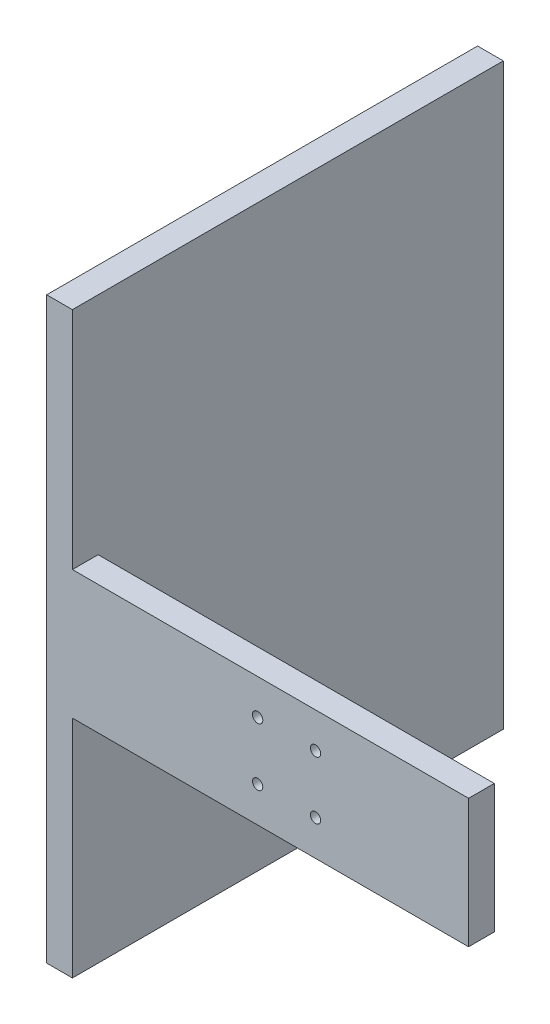
from build123d import *

# Parameters (mm, degrees)
SKETCH1_W           = 65.6
SKETCH1_H           = 20
BOSS_EXTRUDE1_DEPTH = 4
SKETCH2_W           = 67
SKETCH2_H           = 90
BOSS_EXTRUDE2_DEPTH = 4
SKETCH3_R           = 0.8
CUT_EXTRUDE2_DEPTH  = 4
SKETCH4_R           = 0.8
CUT_EXTRUDE4_DEPTH  = 3.5


with BuildPart() as part:
    # Sketch1 → Boss-Extrude1 (new body)
    with BuildSketch(Plane.XY.offset(28)):
        with Locations((-118.3, 0)):
            Rectangle(SKETCH1_W, SKETCH1_H)
    extrude(amount=BOSS_EXTRUDE1_DEPTH)

    # Sketch2 → Boss-Extrude2 (add)
    with BuildSketch(Plane(origin=(-151.1, 0, 0), x_dir=(0, 0, -1), z_dir=(1, 0, 0))):
        with Locations((1.5, 0)):
            Rectangle(SKETCH2_W, SKETCH2_H)
    extrude(amount=BOSS_EXTRUDE2_DEPTH)

    # Sketch3 → Cut-Extrude2 (cut)
    with BuildSketch(Plane.XY.offset(28)):
        with Locations((-109.3, 4.5)):
            Circle(SKETCH3_R)
        with Locations((-109.3, -4.5)):
            Circle(SKETCH3_R)
        with Locations((-118.3, 4.5)):
            Circle(SKETCH3_R)
        with Locations((-118.3, -4.5)):
            Circle(SKETCH3_R)
    extrude(amount=CUT_EXTRUDE2_DEPTH, mode=Mode.SUBTRACT)

    # Sketch4 → Cut-Extrude4 (cut)
    with BuildSketch(Plane(origin=(-151.1, 0, 0), x_dir=(0, 0, -1), z_dir=(1, 0, 0))):
        with Locations((15, -30)):
            Circle(SKETCH4_R)
        with Locations((-15, -30)):
            Circle(SKETCH4_R)
        with Locations((15, 30)):
            Circle(SKETCH4_R)
        with Locations((-15, 30)):
            Circle(SKETCH4_R)
    extrude(amount=CUT_EXTRUDE4_DEPTH, mode=Mode.SUBTRACT)


solid = part.part
